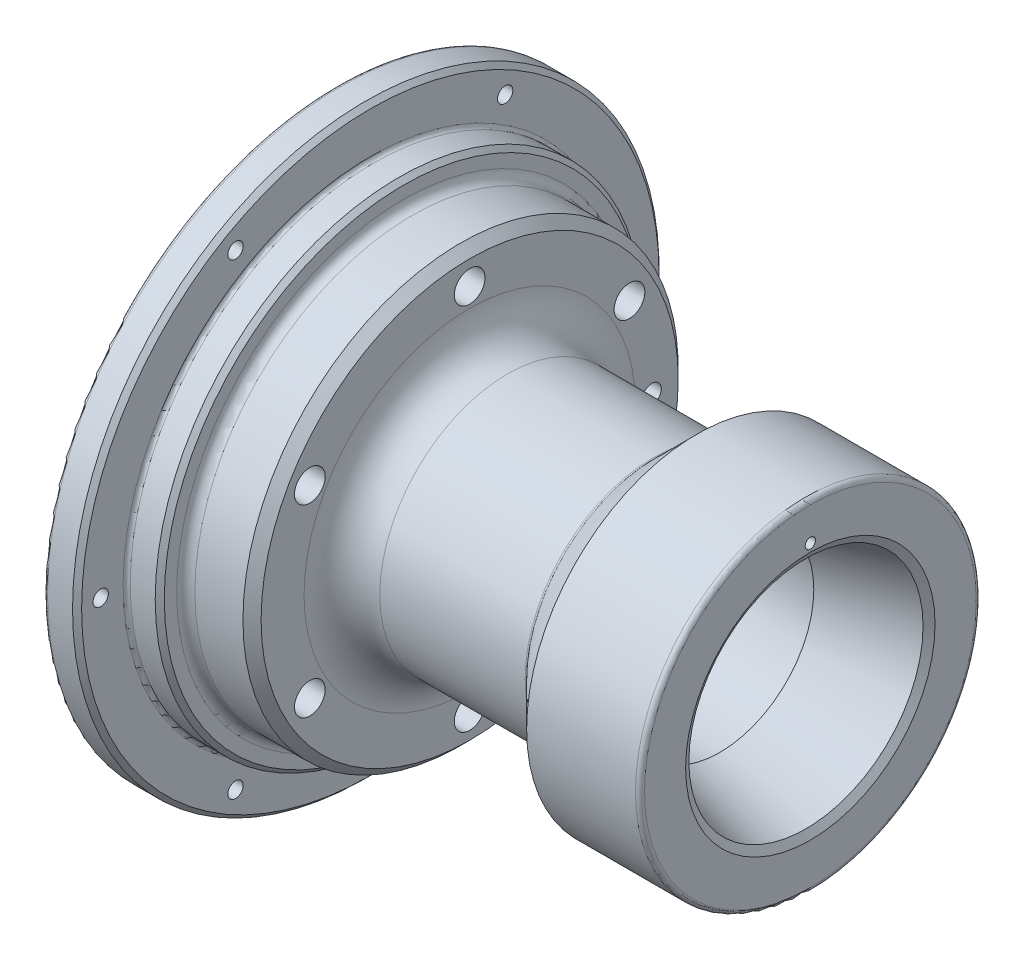
from build123d import *
from OCP.BRepFilletAPI import BRepFilletAPI_MakeChamfer

# Parameters (mm, degrees)
FILLET1_R                   = 12.7
FILLET2_R                   = 3.048
FILLET3_R                   = 1.524
CHAMFER1_SIZE               = 3.048
F_1_4_20_TAPPED_HOLE1_D     = 5.1562
F_1_4_20_TAPPED_HOLE1_DEPTH = 11.1252
F_1_4_20_TAPPED_HOLE1_TIP   = 1.549078762
F_1_4_20_TAPPED_HOLE2_D     = 5.1562
F_1_4_20_TAPPED_HOLE2_DEPTH = 11.1252
F_1_4_20_TAPPED_HOLE2_TIP   = 1.549078762
CUT_EXTRUDE2_START          = -34.925
SKETCH6_R                   = 3.5687
CUT_EXTRUDE2_DEPTH          = 126.279098528
CUT_EXTRUDE4_START          = -34.925
SKETCH7_R                   = 5.1562
CUT_EXTRUDE4_DEPTH          = 19.05
CUT_EXTRUDE6_START          = -34.925
SKETCH8_R                   = 3.5687
CUT_EXTRUDE6_DEPTH          = 126.279098528
CUT_EXTRUDE8_START          = -34.925
SKETCH9_R                   = 5.1562
CUT_EXTRUDE8_DEPTH          = 19.05
CUT_EXTRUDE10_START         = -68.2498
SKETCH10_R                  = 3.175
CUT_EXTRUDE10_DEPTH         = 229.453898528
CUT_EXTRUDE12_START         = -68.2498
SKETCH11_R                  = 4.3688
CUT_EXTRUDE12_DEPTH         = 15.748
CUT_EXTRUDE14_START         = -68.2498
SKETCH12_R                  = 4.77266
CUT_EXTRUDE14_DEPTH         = 14.224
CUT_EXTRUDE16_START         = 79.375
SKETCH13_R                  = 1.7272
CUT_EXTRUDE16_DEPTH         = 30.226
CHAMFER2_SIZE               = 1.524
FILLET4_R                   = 1.1938
CHAMFER3_SIZE               = 1.524
CHAMFER4_SIZE               = 1.524
CHAMFER4_SIZE2              = 2.155261469
FILLET5_R                   = 1.1938


with BuildPart() as part:
    # Sketch1 → Revolve1 (revolve)
    with BuildSketch(Plane(origin=(0, 0, 0), x_dir=(1, 0, 0), z_dir=(0, 1, 0)), mode=Mode.PRIVATE) as revolve1_sk:
        Polygon((-79.375, 98.3996), (-68.2498, 98.3996), (-68.2498, 81.7626), (-57.15, 81.7626), (-57.15, 73.025), (-34.925, 73.025), (-34.925, 42.8625), (27.051, 42.8625), (41.3385, 57.15), (79.375, 57.15), (79.375, 39.687661118), (48.992892692, 31.5468), (-25.273, 31.5468), (-25.273, 30.95625), (-41.275, 30.95625), (-41.275, 34.94405), (-57.1246, 34.94405), (-57.1246, 53.00853), (-68.2498, 53.00853), (-68.2498, 69.9516), (-79.375, 69.9516), align=None)
    revolve(revolve1_sk.sketch.rotate(Axis((-104.775, 0, 0), (1, 0, 0)), 180), axis=Axis((-104.775, 0, 0), (1, 0, 0)))

    # Fillet1
    fillet1_edges = [part.edges().sort_by_distance(p)[0] for p in [
        (-34.925, 0, -42.8625),
    ]]
    fillet(fillet1_edges, radius=FILLET1_R)

    # Fillet2
    fillet2_edges = [part.edges().sort_by_distance(p)[0] for p in [
        (-57.15, 0, -73.025),
    ]]
    fillet(fillet2_edges, radius=FILLET2_R)

    # Fillet3
    fillet3_edges = [part.edges().sort_by_distance(p)[0] for p in [
        (79.375, 0, -57.15),
    ]]
    fillet(fillet3_edges, radius=FILLET3_R)

    # Chamfer1
    chamfer1_edges = [part.edges().sort_by_distance(p)[0] for p in [
        (-34.925, 0, -73.025),
    ]]
    chamfer(chamfer1_edges, length=CHAMFER1_SIZE)

    # 1/4-20 Tapped Hole1
    with Locations(Plane(origin=(-68.2498, 0, 0), x_dir=(0, 0, -1), z_dir=(1, 0, 0))):
        with Locations((-90.4748, 0), (90.4748, 0)):
            Hole(F_1_4_20_TAPPED_HOLE1_D / 2, depth=F_1_4_20_TAPPED_HOLE1_DEPTH)
            with Locations((0, 0, -(F_1_4_20_TAPPED_HOLE1_DEPTH + F_1_4_20_TAPPED_HOLE1_TIP / 2))):  # 118° drill point
                Cone(0, F_1_4_20_TAPPED_HOLE1_D / 2, F_1_4_20_TAPPED_HOLE1_TIP, mode=Mode.SUBTRACT)

    # 1/4-20 Tapped Hole2
    with Locations(Plane(origin=(-68.2498, 0, 0), x_dir=(0, 0, -1), z_dir=(1, 0, 0))):
        with Locations((-45.2374, -78.359), (45.2374, -78.359), (-45.2374, 78.359), (45.2374, 78.359)):
            Hole(F_1_4_20_TAPPED_HOLE2_D / 2, depth=F_1_4_20_TAPPED_HOLE2_DEPTH)
            with Locations((0, 0, -(F_1_4_20_TAPPED_HOLE2_DEPTH + F_1_4_20_TAPPED_HOLE2_TIP / 2))):  # 118° drill point
                Cone(0, F_1_4_20_TAPPED_HOLE2_D / 2, F_1_4_20_TAPPED_HOLE2_TIP, mode=Mode.SUBTRACT)

    # Sketch6 → Cut-Extrude2 (cut, through all)
    with BuildSketch(Plane(origin=(0, 0, 0), x_dir=(0, 0, -1), z_dir=(1, 0, 0)).offset(CUT_EXTRUDE2_START)):
        with Locations((0, -61.9252)):
            Circle(SKETCH6_R)
        with Locations((0, 61.9252)):
            Circle(SKETCH6_R)
    extrude(amount=-CUT_EXTRUDE2_DEPTH, mode=Mode.SUBTRACT)

    # Sketch7 → Cut-Extrude4 (cut)
    with BuildSketch(Plane(origin=(0, 0, 0), x_dir=(0, 0, -1), z_dir=(1, 0, 0)).offset(CUT_EXTRUDE4_START)):
        with Locations((0, -61.9252)):
            Circle(SKETCH7_R)
        with Locations((0, 61.9252)):
            Circle(SKETCH7_R)
    extrude(amount=-CUT_EXTRUDE4_DEPTH, mode=Mode.SUBTRACT)

    # Sketch8 → Cut-Extrude6 (cut, through all)
    with BuildSketch(Plane(origin=(0, 0, 0), x_dir=(0, 0, -1), z_dir=(1, 0, 0)).offset(CUT_EXTRUDE6_START)):
        with Locations((-53.6194, -30.9372)):
            Circle(SKETCH8_R)
        with Locations((53.6194, -30.9372)):
            Circle(SKETCH8_R)
        with Locations((-53.6194, 30.9372)):
            Circle(SKETCH8_R)
        with Locations((53.6194, 30.9372)):
            Circle(SKETCH8_R)
    extrude(amount=-CUT_EXTRUDE6_DEPTH, mode=Mode.SUBTRACT)

    # Sketch9 → Cut-Extrude8 (cut)
    with BuildSketch(Plane(origin=(0, 0, 0), x_dir=(0, 0, -1), z_dir=(1, 0, 0)).offset(CUT_EXTRUDE8_START)):
        with Locations((-53.6194, -30.9372)):
            Circle(SKETCH9_R)
        with Locations((53.6194, -30.9372)):
            Circle(SKETCH9_R)
        with Locations((-53.6194, 30.9372)):
            Circle(SKETCH9_R)
        with Locations((53.6194, 30.9372)):
            Circle(SKETCH9_R)
    extrude(amount=-CUT_EXTRUDE8_DEPTH, mode=Mode.SUBTRACT)

    # Sketch10 → Cut-Extrude10 (cut, through all)
    with BuildSketch(Plane(origin=(0, 0, 0), x_dir=(0, 0, -1), z_dir=(1, 0, 0)).offset(CUT_EXTRUDE10_START)):
        with Locations(Location((61.1124, 0, 0), (0, 0, 180))):
            Circle(SKETCH10_R)
    extrude(amount=CUT_EXTRUDE10_DEPTH, mode=Mode.SUBTRACT)

    # Sketch11 → Cut-Extrude12 (cut)
    with BuildSketch(Plane(origin=(0, 0, 0), x_dir=(0, 0, -1), z_dir=(1, 0, 0)).offset(CUT_EXTRUDE12_START)):
        with Locations((61.1124, 0)):
            Circle(SKETCH11_R)
    extrude(amount=CUT_EXTRUDE12_DEPTH, mode=Mode.SUBTRACT)

    # Sketch12 → Cut-Extrude14 (cut)
    with BuildSketch(Plane(origin=(0, 0, 0), x_dir=(0, 0, -1), z_dir=(1, 0, 0)).offset(CUT_EXTRUDE14_START)):
        with Locations((61.1124, 0)):
            Circle(SKETCH12_R)
    extrude(amount=CUT_EXTRUDE14_DEPTH, mode=Mode.SUBTRACT)

    # Sketch13 → Cut-Extrude16 (cut)
    with BuildSketch(Plane(origin=(0, 0, 0), x_dir=(0, 0, -1), z_dir=(1, 0, 0)).offset(CUT_EXTRUDE16_START)):
        with Locations((0, 44.45)):
            Circle(SKETCH13_R)
    extrude(amount=-CUT_EXTRUDE16_DEPTH, mode=Mode.SUBTRACT)

    # Chamfer2
    chamfer2_edges = [part.edges().sort_by_distance(p)[0] for p in [
        (-68.2498, 0, -98.3996),
    ]]
    chamfer(chamfer2_edges, length=CHAMFER2_SIZE)

    # Fillet4
    fillet4_edges = [part.edges().sort_by_distance(p)[0] for p in [
        (-79.375, 0, -98.3996),
    ]]
    fillet(fillet4_edges, radius=FILLET4_R)

    # Chamfer3
    chamfer3_edges = [part.edges().sort_by_distance(p)[0] for p in [
        (-41.275, 0, -30.95625),
    ]]
    chamfer(chamfer3_edges, length=CHAMFER3_SIZE)

    # Chamfer4: one chamfer whose edges measure the first distance from different faces: ONE call of the kernel's chamfer builder (chamfer() names one face for all edges)
    chamfer4_edges_1 = [part.edges().sort_by_distance(p)[0] for p in [
        (-79.375, 0, -69.9516),
        (-68.2498, 0, -53.00853),
        (-57.1246, 0, -34.94405),
        (-57.15, 0, -81.7626),
    ]]
    chamfer4_edges_2 = [part.edges().sort_by_distance(p)[0] for p in [
        (79.375, 0, -39.687661118),
    ]]
    chamfer4_side_2 = [part.faces().sort_by_distance(p)[0] for p in [
        (64.183946346, 0, -35.617230559),
    ]]
    chamfer4 = BRepFilletAPI_MakeChamfer(part.part.solid().wrapped)
    for e in chamfer4_edges_1:
        chamfer4.Add(CHAMFER4_SIZE, e.wrapped)
    for e in chamfer4_edges_2:
        chamfer4.Add(CHAMFER4_SIZE, CHAMFER4_SIZE2, e.wrapped, chamfer4_side_2[0].wrapped)  # the first distance lies on this face
    add(Compound.cast(chamfer4.Shape()), mode=Mode.REPLACE)

    # Fillet5
    fillet5_edges = [part.edges().sort_by_distance(p)[0] for p in [
        (-68.2498, 0, -69.9516),
        (-57.1246, 0, -53.00853),
        (-41.275, 0, -34.94405),
        (27.051, 0, -42.8625),
        (-68.2498, 0, -81.7626),
    ]]
    fillet(fillet5_edges, radius=FILLET5_R)


solid = part.part
